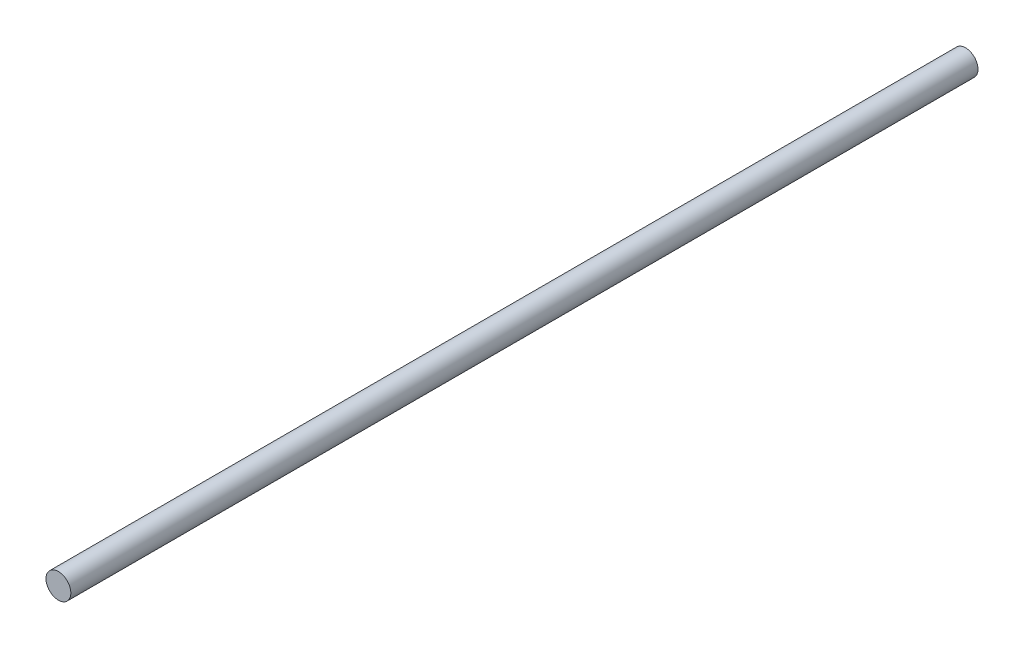
from build123d import *

# Parameters (mm, degrees)
SKETCH1_R           = 6.35
BOSS_EXTRUDE1_DEPTH = 463.55


with BuildPart() as part:
    # Sketch1 → Boss-Extrude1 (new body)
    with BuildSketch(Plane.XY):
        Circle(SKETCH1_R)
    extrude(amount=BOSS_EXTRUDE1_DEPTH)


solid = part.part
